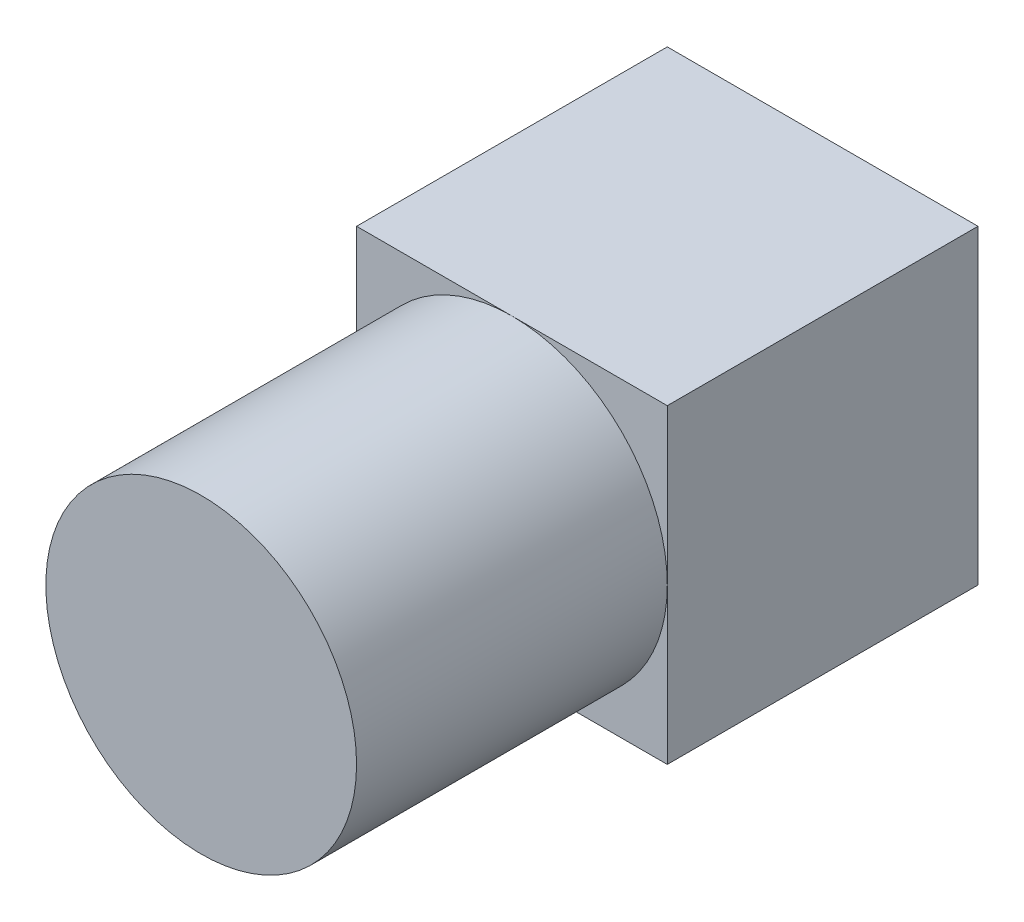
from build123d import *

# Parameters (mm, degrees)
SKETCH1_W           = 2.54
SKETCH1_H           = 2.54
BOSS_EXTRUDE1_DEPTH = 2.54
SKETCH2_R           = 1.27
BOSS_EXTRUDE2_DEPTH = 2.54


with BuildPart() as part:
    # Sketch1 → Boss-Extrude1 (new body)
    with BuildSketch(Plane.XY):
        Rectangle(SKETCH1_W, SKETCH1_H)
    extrude(amount=-BOSS_EXTRUDE1_DEPTH)

    # Sketch2 → Boss-Extrude2 (add)
    with BuildSketch(Plane.XY):
        Circle(SKETCH2_R)
    extrude(amount=BOSS_EXTRUDE2_DEPTH)


solid = part.part
